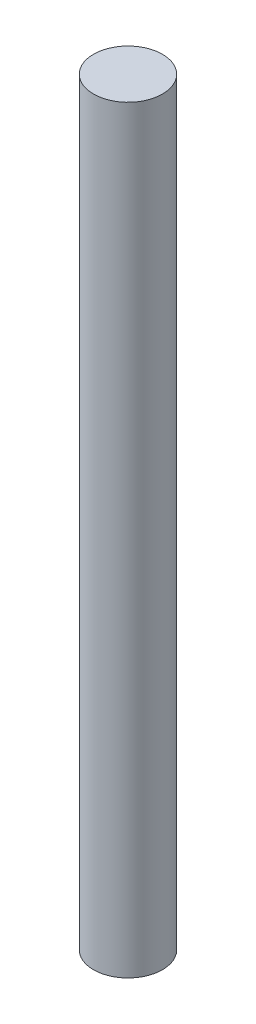
from build123d import *

# Parameters (mm, degrees)
SKETCH1_R           = 2.5
BOSS_EXTRUDE1_DEPTH = 55


with BuildPart() as part:
    # Sketch1 → Boss-Extrude1 (new body)
    with BuildSketch(Plane(origin=(0, 0, 0), x_dir=(1, 0, 0), z_dir=(0, 1, 0))):
        with Locations(Location((0, 0, 0), (0, 0, 270))):
            Circle(SKETCH1_R)
    extrude(amount=BOSS_EXTRUDE1_DEPTH)


solid = part.part
